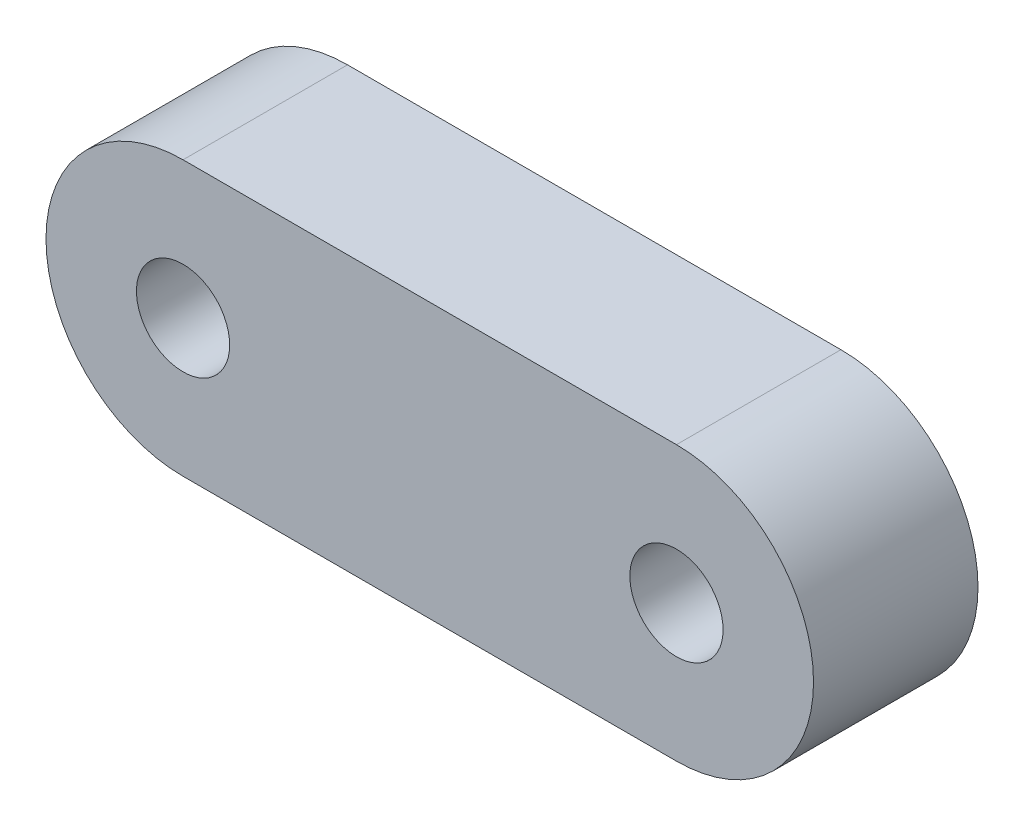
from build123d import *

# Parameters (mm, degrees)
SKETCH2_R           = 1.7
BOSS_EXTRUDE1_DEPTH = 6


with BuildPart() as part:
    # Sketch2 → Boss-Extrude1 (new body)
    with BuildSketch(Plane.XY):
        with BuildLine():
            Line((7.56, 5), (25.56, 5))
            ThreePointArc((25.56, 5), (30.56, 0), (25.56, -5))
            Line((25.56, -5), (7.56, -5))
            ThreePointArc((7.56, -5), (2.56, 0), (7.56, 5))
        make_face()
        with Locations((7.56, 0)):
            Circle(SKETCH2_R, mode=Mode.SUBTRACT)
        with Locations((25.56, 0)):
            Circle(SKETCH2_R, mode=Mode.SUBTRACT)
    extrude(amount=BOSS_EXTRUDE1_DEPTH)


solid = part.part
